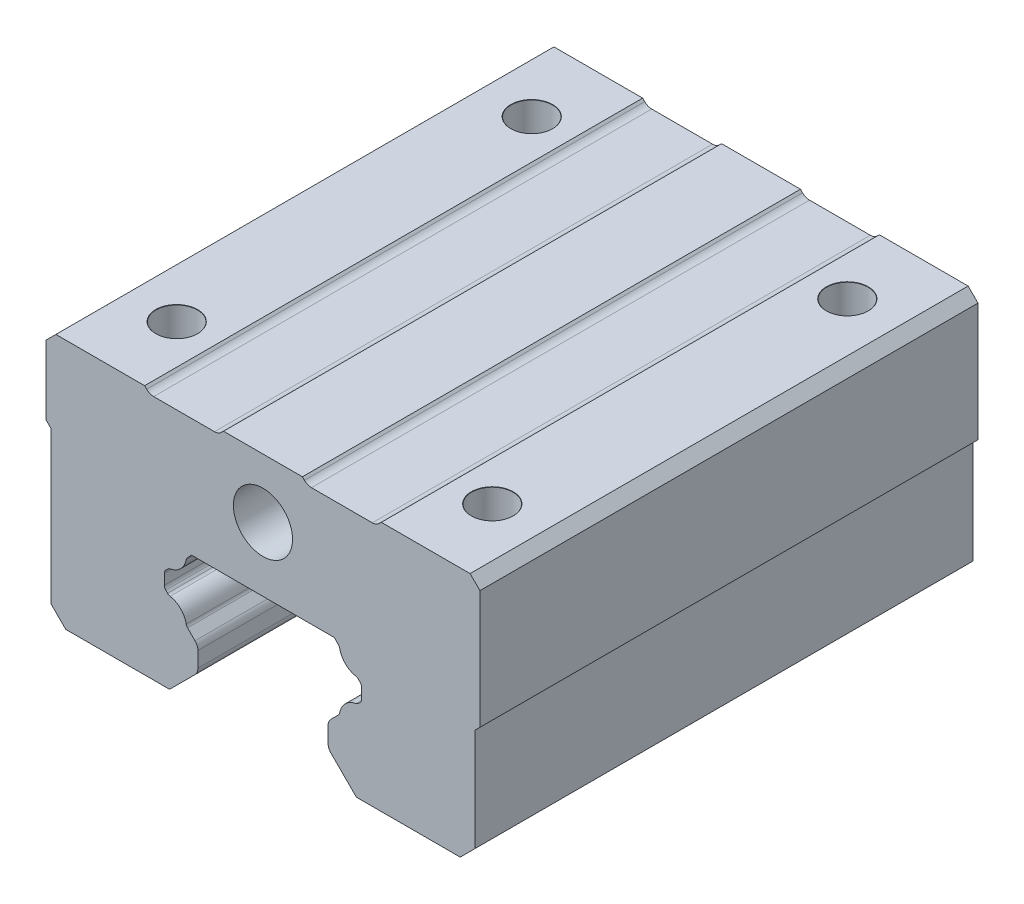
from build123d import *

# Parameters (mm, degrees)
BLOCK_DEPTH                           = 25.25
TAP_DRILL_FOR_M5X0_8_TAP1_D           = 4.2
TAP_DRILL_FOR_M5X0_8_TAP1_DEPTH       = 7.5
TAP_DRILL_FOR_M5X0_8_TAP1_CSINK_D     = 4.25
TAP_DRILL_FOR_M5X0_8_TAP1_CSINK_ANGLE = 90
TAP_DRILL_FOR_M5X0_8_TAP1_TIP         = 1.093190806
F_6_0_6_DIAMETER_HOLE1_D              = 6


with BuildPart() as part:
    # Sketch2 → Block (new, symmetric)
    with BuildSketch(Plane.XY):
        with BuildLine():
            Line((-7.230720611, 12.9), (7.230720611, 12.9))
            Line((7.230720611, 12.9), (7.647672674, 12.483047938))
            ThreePointArc((7.647672674, 12.483047938), (7.736182466, 12.363118479), (7.785406885, 12.222427275))
            ThreePointArc((7.785406885, 12.222427275), (8.344607784, 11.164307384), (9.402727675, 10.605106485))
            ThreePointArc((9.402727675, 10.605106485), (9.54341888, 10.555882066), (9.663348338, 10.467372274))
            Line((9.663348338, 10.467372274), (9.853553391, 10.277167221))
            ThreePointArc((9.853553391, 10.277167221), (9.961939766, 10.114955546), (10, 9.92361383))
            Line((10, 9.92361383), (10, 8.86638617))
            ThreePointArc((10, 8.86638617), (9.961939766, 8.675044454), (9.853553391, 8.512832779))
            Line((9.853553391, 8.512832779), (9.675343394, 8.334622782))
            ThreePointArc((9.675343394, 8.334622782), (9.554347216, 8.245550888), (9.412352167, 8.19644607))
            ThreePointArc((9.412352167, 8.19644607), (8.344607784, 7.635448616), (7.783610331, 6.567704234))
            ThreePointArc((7.783610331, 6.567704234), (7.734505512, 6.425709184), (7.645433618, 6.304713007))
            Line((7.645433618, 6.304713007), (6.892893219, 5.552172608))
            ThreePointArc((6.892893219, 5.552172608), (6.676120468, 5.227749259), (6.6, 4.845065826))
            Line((6.6, 4.845065826), (6.6, 3.284934173))
            ThreePointArc((6.6, 3.284934173), (6.676120468, 2.902250741), (6.892893219, 2.577827392))
            Line((6.892893219, 2.577827392), (9.470720611, 0))
            Line((9.470720611, 0), (19.9998779, 0))
            Line((19.9998779, 0), (21.5001221, 1.5))
            Line((21.5001221, 1.5), (21.5001221, 11.9))
            Line((21.5001221, 11.9), (22, 12.3997558))
            Line((22, 12.3997558), (22, 24.4))
            Line((22, 24.4), (20.9998779, 25.4))
            Line((20.9998779, 25.4), (11.9998779, 25.4))
            Line((11.9998779, 25.4), (11.792771119, 25.192893219))
            ThreePointArc((11.792771119, 25.192893219), (11.46834777, 24.976120467), (11.085664338, 24.9))
            Line((11.085664338, 24.9), (4.914091462, 24.9))
            ThreePointArc((4.914091462, 24.9), (4.53140803, 24.976120467), (4.206984681, 25.192893219))
            Line((4.206984681, 25.192893219), (4.0001221, 25.4))
            Line((4.0001221, 25.4), (-3.9998779, 25.4))
            Line((-3.9998779, 25.4), (-4.206984681, 25.192893219))
            ThreePointArc((-4.206984681, 25.192893219), (-4.53140803, 24.976120467), (-4.914091462, 24.9))
            Line((-4.914091462, 24.9), (-11.085664338, 24.9))
            ThreePointArc((-11.085664338, 24.9), (-11.46834777, 24.976120467), (-11.792771119, 25.192893219))
            Line((-11.792771119, 25.192893219), (-11.9998779, 25.4))
            Line((-11.9998779, 25.4), (-20.9998779, 25.4))
            Line((-20.9998779, 25.4), (-22, 24.4))
            Line((-22, 24.4), (-22, 17.4))
            Line((-22, 17.4), (-21.5001221, 16.9002442))
            Line((-21.5001221, 16.9002442), (-21.5001221, 1.5))
            Line((-21.5001221, 1.5), (-19.9998779, 0))
            Line((-19.9998779, 0), (-9.470720611, 0))
            Line((-9.470720611, 0), (-6.892893219, 2.577827392))
            ThreePointArc((-6.892893219, 2.577827392), (-6.676120468, 2.902250741), (-6.6, 3.284934173))
            Line((-6.6, 3.284934173), (-6.6, 4.845065826))
            ThreePointArc((-6.6, 4.845065826), (-6.676120468, 5.227749259), (-6.892893219, 5.552172608))
            Line((-6.892893219, 5.552172608), (-7.645433618, 6.304713006))
            ThreePointArc((-7.645433618, 6.304713006), (-7.734505512, 6.425709184), (-7.783610331, 6.567704233))
            ThreePointArc((-7.783610331, 6.567704233), (-8.344607784, 7.635448616), (-9.412352167, 8.19644607))
            ThreePointArc((-9.412352167, 8.19644607), (-9.554347216, 8.245550888), (-9.675343394, 8.334622782))
            Line((-9.675343394, 8.334622782), (-9.853553391, 8.512832779))
            ThreePointArc((-9.853553391, 8.512832779), (-9.961939766, 8.675044454), (-10, 8.86638617))
            Line((-10, 8.86638617), (-10, 9.92361383))
            ThreePointArc((-10, 9.92361383), (-9.961939766, 10.114955546), (-9.853553391, 10.277167221))
            Line((-9.853553391, 10.277167221), (-9.663348338, 10.467372274))
            ThreePointArc((-9.663348338, 10.467372274), (-9.543418879, 10.555882066), (-9.402727675, 10.605106485))
            ThreePointArc((-9.402727675, 10.605106485), (-8.344607784, 11.164307384), (-7.785406885, 12.222427275))
            ThreePointArc((-7.785406885, 12.222427275), (-7.736182466, 12.363118479), (-7.647672674, 12.483047938))
            Line((-7.647672674, 12.483047938), (-7.230720611, 12.9))
        make_face()
    extrude(amount=BLOCK_DEPTH, both=True)

    # Tap Drill for M5x0.8 Tap1
    with Locations(Plane(origin=(0, 25.4, 0), x_dir=(1, 0, 0), z_dir=(0, 1, 0))):
        with Locations((16, 18), (-16, 18), (16, -18), (-16, -18)):
            CounterSinkHole(TAP_DRILL_FOR_M5X0_8_TAP1_D / 2, TAP_DRILL_FOR_M5X0_8_TAP1_CSINK_D / 2, depth=TAP_DRILL_FOR_M5X0_8_TAP1_DEPTH, counter_sink_angle=TAP_DRILL_FOR_M5X0_8_TAP1_CSINK_ANGLE)
            with Locations((0, 0, -(TAP_DRILL_FOR_M5X0_8_TAP1_DEPTH + TAP_DRILL_FOR_M5X0_8_TAP1_TIP / 2))):  # 125° drill point
                Cone(0, TAP_DRILL_FOR_M5X0_8_TAP1_D / 2, TAP_DRILL_FOR_M5X0_8_TAP1_TIP, mode=Mode.SUBTRACT)

    # Ø6.0 (6) Diameter Hole1 (through all)
    with Locations(Plane(origin=(0, 0, -25.25), x_dir=(-1, 0, 0), z_dir=(0, 0, -1))):
        with Locations((0, 19.4)):
            Hole(F_6_0_6_DIAMETER_HOLE1_D / 2)


solid = part.part
